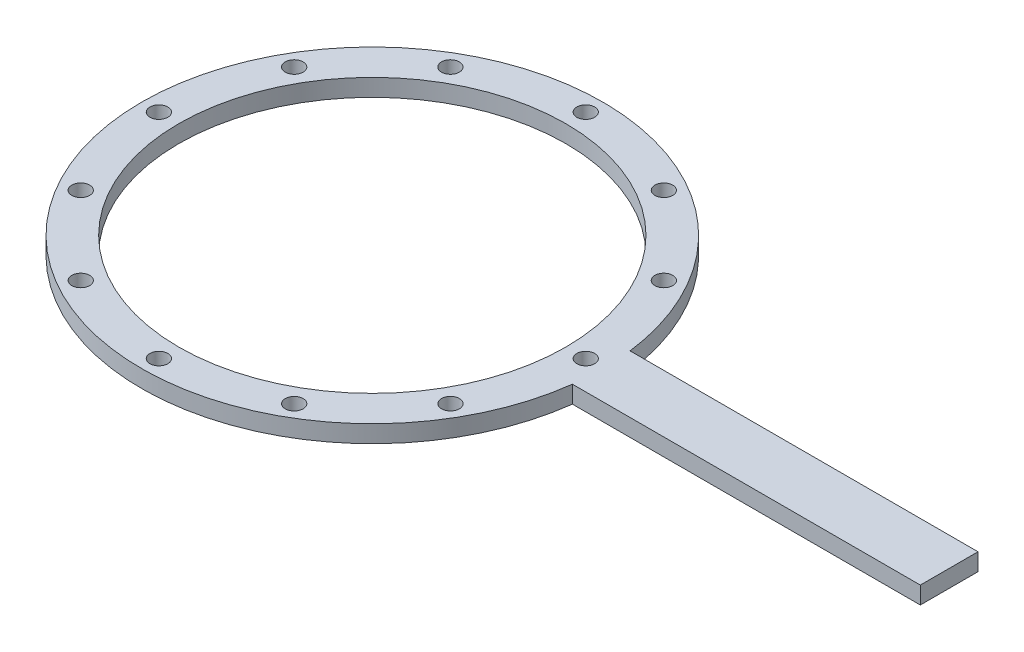
from build123d import *

# Parameters (mm, degrees)
SKETCH1_R           = 40
SKETCH1_R_2         = 33.55
SKETCH1_W           = 60.313730334
SKETCH1_H           = 10
BOSS_EXTRUDE1_DEPTH = 3
SKETCH2_R           = 1.55
CUT_EXTRUDE1_DEPTH  = 108.745069493
CIRPATTERN1_COUNT   = 12


with BuildPart() as part:
    # Sketch1 → Boss-Extrude1 (new body)
    # profile 1 of 2: a face of its own
    with BuildSketch(Plane(origin=(0, 0, 0), x_dir=(1, 0, 0), z_dir=(0, 1, 0))):
        Circle(SKETCH1_R)
        with Locations(Location((0, 0, 0), (0, 0, 270))):
            Circle(SKETCH1_R_2, mode=Mode.SUBTRACT)
    # profile 2 of 2: a face of its own
    with BuildSketch(Plane(origin=(0, 0, 0), x_dir=(1, 0, 0), z_dir=(0, 1, 0))):
        with Locations((69.843134833, 0)):
            Rectangle(SKETCH1_W, SKETCH1_H)
    extrude(amount=BOSS_EXTRUDE1_DEPTH)

    # Sketch2 → Cut-Extrude1 (cut, through all)
    with BuildSketch(Plane(origin=(0, 3, 0), x_dir=(1, 0, 0), z_dir=(0, 1, 0))):
        with Locations(Location((37, 0, 0), (0, 0, 270))):
            Circle(SKETCH2_R)
    cut_extrude1 = extrude(amount=-CUT_EXTRUDE1_DEPTH, mode=Mode.SUBTRACT)

    # CirPattern1: Cut-Extrude1 ×12 about axis
    cirpattern1_axis = Axis((0, 0, 0), (0, 1, 0))
    for i in range(1, CIRPATTERN1_COUNT):
        add(cut_extrude1.rotate(cirpattern1_axis, i * 360 / CIRPATTERN1_COUNT), mode=Mode.SUBTRACT)


solid = part.part
